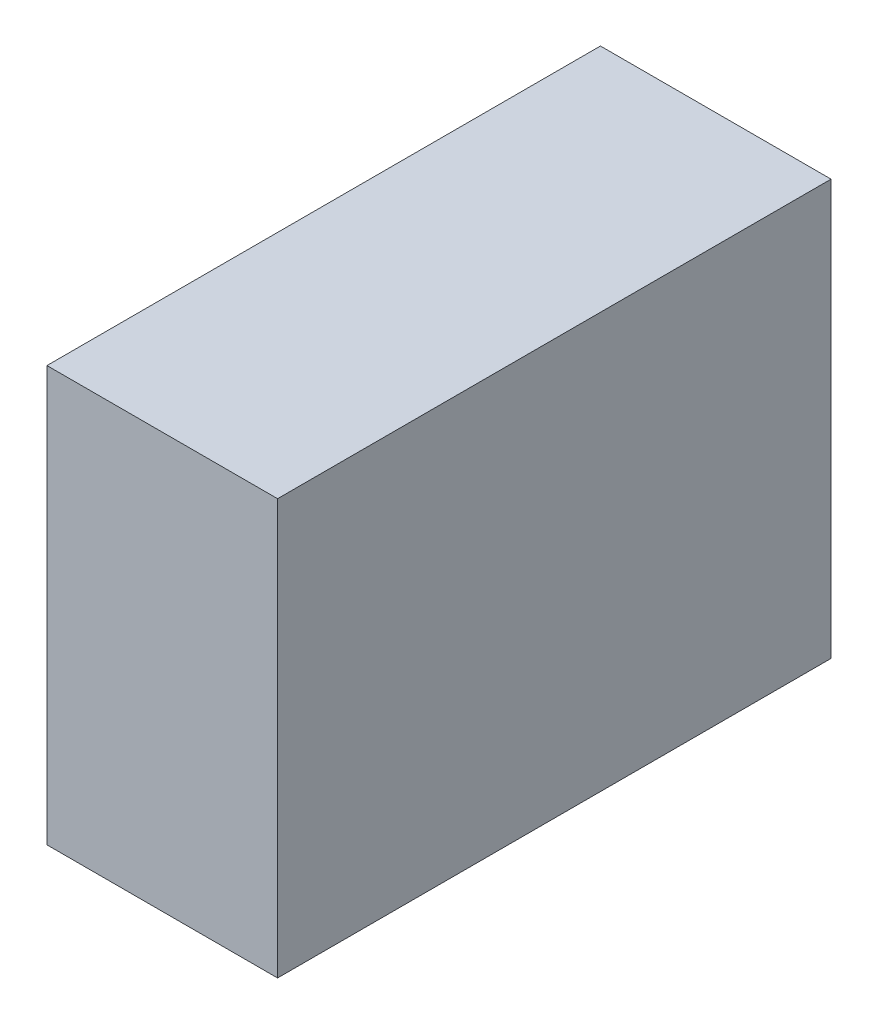
from build123d import *

# Parameters (mm, degrees)
SKETCH_1_W      = 50
SKETCH_1_H      = 90
EXTRUDE_1_DEPTH = 120


with BuildPart() as part:
    # 스케치1 → 보스-돌출1 (new body)
    with BuildSketch(Plane.XY):
        with Locations((25, 45)):
            Rectangle(SKETCH_1_W, SKETCH_1_H)
    extrude(amount=EXTRUDE_1_DEPTH)


solid = part.part
